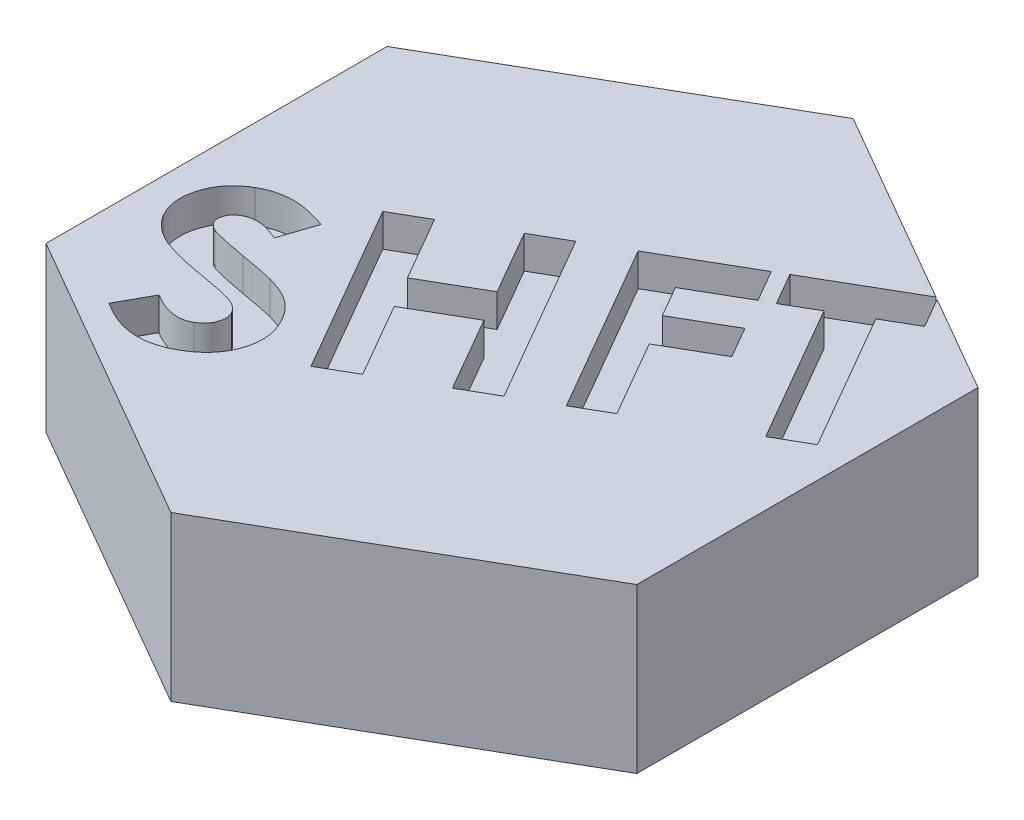
from build123d import *

# Parameters (mm, degrees)
BOSS_EXTRUDE1_DEPTH = 5
SHELL1_T            = -1
BOSS_EXTRUDE2_DEPTH = 2
SKETCH3_W           = 6.8
SKETCH3_H           = 4.9
BOSS_EXTRUDE3_DEPTH = 3.5
CUT_EXTRUDE1_DEPTH  = 3.5
CUT_EXTRUDE2_DEPTH  = 1


with BuildPart() as part:
    # Sketch1 → Boss-Extrude1 (new body)
    with BuildSketch(Plane(origin=(0, 0, 0), x_dir=(1, 0, 0), z_dir=(0, 1, 0))):
        Polygon((9.025, 5.210586179), (0, 10.421172359), (-9.025, 5.210586179), (-9.025, -5.210586179), (0, -10.421172359), (9.025, -5.210586179), align=None)
    extrude(amount=BOSS_EXTRUDE1_DEPTH)

    # Shell1
    shell1_openings = [part.faces().sort_by_distance(p)[0] for p in [
        (0, 0, 0),
    ]]
    offset(amount=SHELL1_T, openings=shell1_openings, kind=Kind.INTERSECTION)

    # Sketch2 → Boss-Extrude2 (add)
    with BuildSketch(Plane.XZ.offset(-4)):
        Polygon((8.025, -4.63323591), (8.025, 4.63323591), (0, 9.26647182), (-8.025, 4.63323591), (-8.025, -4.63323591), (0, -9.26647182), align=None)
    extrude(amount=BOSS_EXTRUDE2_DEPTH)

    # Sketch3 → Boss-Extrude3 (add)
    with BuildSketch(Plane.XZ.offset(-2)):
        Rectangle(SKETCH3_W, SKETCH3_H)
    extrude(amount=BOSS_EXTRUDE3_DEPTH)

    # Sketch4 → Cut-Extrude1 (cut)
    with BuildSketch(Plane.XZ.offset(1.5)):
        Polygon((2.1, -0.65), (2.1, 0.65), (0.75, 0.65), (0.75, 2.1), (-0.75, 2.1), (-0.75, 0.65), (-2.1, 0.65), (-2.1, -0.65), (-0.75, -0.65), (-0.75, -2.1), (0.75, -2.1), (0.75, -0.65), align=None)
    extrude(amount=-CUT_EXTRUDE1_DEPTH, mode=Mode.SUBTRACT)

    # Sketch5 → Cut-Extrude2 (cut)
    with BuildSketch(Plane(origin=(0, 5, 0), x_dir=(1, 0, 0), z_dir=(0, 1, 0))):
        with BuildLine():
            Line((-5.325433461, -0.506892934), (-5.682404615, -1.575402549))
            add(Edge.make_bspline(
                [(-5.682404615, -1.575402549), (-5.738611571, -1.55146657), (-5.846580721, -1.505487433), (-6.00645553, -1.450457601), (-6.157396888, -1.414148084), (-6.299119737, -1.39335946), (-6.432402529, -1.39262203), (-6.556831326, -1.405715783), (-6.672502146, -1.438161724), (-6.741797161, -1.473664937), (-6.776154615, -1.491267934)],
                knots=[0, 0, 0, 0, 1.28771263, 2.473594846, 3.559332536, 4.55671893, 5.485823958, 6.361652317, 7.187683927, 8, 8, 8, 8], degree=3))
            add(Edge.make_bspline(
                [(-6.776154615, -1.491267934), (-6.806492545, -1.510352721), (-6.864710582, -1.546976143), (-6.938739485, -1.61588131), (-6.99599337, -1.693290765), (-7.035307029, -1.777376197), (-7.058013134, -1.861350567), (-7.065305532, -1.942177188), (-7.054051685, -2.018272363), (-7.032137808, -2.062995336), (-7.021346922, -2.085017934)],
                knots=[0, 0, 0, 0, 1.209748172, 2.321488709, 3.39707423, 4.445359682, 5.44094777, 6.3240213, 7.174710374, 8, 8, 8, 8], degree=3))
            add(Edge.make_bspline(
                [(-7.021346922, -2.085017934), (-7.007656472, -2.106037373), (-6.980319555, -2.148008721), (-6.925567054, -2.201021253), (-6.862951825, -2.247786346), (-6.815080973, -2.270504668), (-6.790577692, -2.282133319)],
                knots=[0, 0, 0, 0, 0.973157049, 1.943187581, 2.947195419, 4, 4, 4, 4], degree=3))
            add(Edge.make_bspline(
                [(-6.790577692, -2.282133319), (-6.769858792, -2.290097745), (-6.7215347, -2.308673716), (-6.63598808, -2.33053668), (-6.529832527, -2.359308535), (-6.401725396, -2.388293787), (-6.252497256, -2.421379678), (-6.081066664, -2.454151642), (-5.88849741, -2.491724711), (-5.752544005, -2.516649981), (-5.681202692, -2.529729472)],
                knots=[0, 0, 0, 0, 0.467887767, 1.091286356, 1.859988272, 2.788638217, 3.861161716, 5.084362453, 6.470024239, 8, 8, 8, 8], degree=3))
            add(Edge.make_bspline(
                [(-5.681202692, -2.529729472), (-5.614688545, -2.541707449), (-5.488466865, -2.564437657), (-5.309075132, -2.597398063), (-5.149619325, -2.624932828), (-5.010942301, -2.653591474), (-4.892650506, -2.677133355), (-4.794430155, -2.697661701), (-4.716489125, -2.714957182), (-4.671549695, -2.727498295), (-4.652356538, -2.732854472)],
                knots=[0, 0, 0, 0, 1.546287761, 2.93433875, 4.173173077, 5.24819644, 6.174012619, 6.932675225, 7.544156831, 8, 8, 8, 8], degree=3))
            add(Edge.make_bspline(
                [(-4.652356538, -2.732854472), (-4.576623584, -2.754433542), (-4.430948197, -2.795941753), (-4.228232443, -2.875630456), (-4.047908963, -2.962859498), (-3.890344122, -3.062664527), (-3.751179655, -3.17552418), (-3.624703925, -3.301019132), (-3.512720637, -3.444029872), (-3.448277986, -3.547923786), (-3.415577692, -3.600642934)],
                knots=[0, 0, 0, 0, 1.214203853, 2.335570051, 3.355534606, 4.300291848, 5.205716251, 6.114761862, 7.043368914, 8, 8, 8, 8], degree=3))
            add(Edge.make_bspline(
                [(-3.415577692, -3.600642934), (-3.386940184, -3.653439855), (-3.330617955, -3.757277112), (-3.264417801, -3.919102949), (-3.215768933, -4.082115905), (-3.185465465, -4.246531266), (-3.173372547, -4.41177459), (-3.179504364, -4.578223869), (-3.204041341, -4.745238515), (-3.244721037, -4.911960498), (-3.30204991, -5.075343685), (-3.377031051, -5.231803254), (-3.467113417, -5.380417938), (-3.574802899, -5.519417001), (-3.695616106, -5.652007924), (-3.834104159, -5.775095202), (-3.988505341, -5.889617335), (-4.100107682, -5.957675309), (-4.15716423, -5.992469857)],
                knots=[0, 0, 0, 0, 1.025678726, 2.017232489, 2.981083202, 3.927665712, 4.867989921, 5.806443481, 6.767762737, 7.747334686, 8.73460219, 9.720539785, 10.706714995, 11.69798516, 12.720254519, 13.76740984, 14.858591258, 16, 16, 16, 16], degree=3))
            add(Edge.make_bspline(
                [(-4.15716423, -5.992469857), (-4.2029151, -6.017928425), (-4.293326345, -6.068238741), (-4.43299698, -6.132088815), (-4.573498408, -6.183443266), (-4.714079103, -6.224567518), (-4.854784589, -6.256505215), (-4.996764563, -6.275817947), (-5.139055192, -6.282263566), (-5.281711595, -6.280685803), (-5.425609337, -6.265765459), (-5.571059365, -6.239249342), (-5.718130016, -6.200666559), (-5.86656675, -6.149043701), (-6.01792839, -6.088380432), (-6.170664985, -6.014503942), (-6.325132479, -5.928971262), (-6.426330514, -5.864420115), (-6.478077692, -5.831412165)],
                knots=[0, 0, 0, 0, 1.017774509, 2.011289818, 2.982347635, 3.9240255, 4.857710421, 5.785363618, 6.705792502, 7.625165849, 8.556898814, 9.514964358, 10.497515854, 11.510029584, 12.568949849, 13.666508622, 14.80677927, 16, 16, 16, 16], degree=3))
            Line((-6.478077692, -5.831412165), (-5.93841423, -4.849441011))
            add(Edge.make_bspline(
                [(-5.93841423, -4.849441011), (-5.876066943, -4.885737418), (-5.756838552, -4.955148012), (-5.576733209, -5.038518479), (-5.405875784, -5.100678252), (-5.242445562, -5.135796737), (-5.0879048, -5.149004574), (-4.941778751, -5.138495445), (-4.803236577, -5.10468289), (-4.720183882, -5.061876928), (-4.678798845, -5.04054678)],
                knots=[0, 0, 0, 0, 1.293579815, 2.47374744, 3.555769028, 4.54819344, 5.46380976, 6.3287118, 7.167199521, 8, 8, 8, 8], degree=3))
            add(Edge.make_bspline(
                [(-4.678798845, -5.04054678), (-4.638936237, -5.015446967), (-4.561347561, -4.966592631), (-4.464150913, -4.872487164), (-4.387701145, -4.765879064), (-4.334443541, -4.648855696), (-4.303317377, -4.529157536), (-4.294197846, -4.412572162), (-4.313533945, -4.301642045), (-4.345449099, -4.235867679), (-4.361491153, -4.202806396)],
                knots=[0, 0, 0, 0, 1.138617944, 2.216208663, 3.252996335, 4.299549031, 5.311698101, 6.23549815, 7.113078549, 8, 8, 8, 8], degree=3))
            add(Edge.make_bspline(
                [(-4.361491153, -4.202806396), (-4.380010417, -4.173871492), (-4.4175359, -4.115240856), (-4.4965852, -4.041680531), (-4.589626245, -3.976678965), (-4.680359291, -3.930555918), (-4.765056268, -3.897993387), (-4.843056545, -3.872966048), (-4.933757848, -3.846171338), (-5.038856401, -3.822065238), (-5.155920712, -3.794858002), (-5.286890039, -3.77045363), (-5.430568678, -3.743553698), (-5.531326246, -3.727039534), (-5.583846922, -3.718431396)],
                knots=[0, 0, 0, 0, 0.909424095, 1.84276103, 2.843738267, 3.919499091, 4.536166438, 5.253068241, 6.095165878, 7.047724124, 8.116724405, 9.287726519, 10.586206066, 12, 12, 12, 12], degree=3))
            add(Edge.make_bspline(
                [(-5.583846922, -3.718431396), (-5.683655771, -3.701485292), (-5.875498665, -3.668913133), (-6.150918918, -3.617525985), (-6.401889951, -3.56506577), (-6.628381182, -3.511091226), (-6.830571857, -3.456261035), (-7.008205883, -3.400069991), (-7.161834982, -3.344104119), (-7.293538663, -3.286043885), (-7.407482868, -3.222236129), (-7.512689732, -3.158161164), (-7.608810661, -3.087752964), (-7.698405428, -3.014463112), (-7.780415921, -2.936493879), (-7.853571897, -2.853349852), (-7.919489932, -2.766364229), (-7.956953592, -2.704748877), (-7.975673845, -2.673960242)],
                knots=[0, 0, 0, 0, 1.801703634, 3.463060095, 4.985942132, 6.364289375, 7.606258193, 8.713464438, 9.679023598, 10.515207159, 11.27148115, 12.001589174, 12.706147237, 13.389942357, 14.060675862, 14.717353214, 15.359072975, 16, 16, 16, 16], degree=3))
            add(Edge.make_bspline(
                [(-7.975673845, -2.673960242), (-7.999795613, -2.629122769), (-8.047616039, -2.540234299), (-8.103161683, -2.400567973), (-8.141164791, -2.257609045), (-8.166399838, -2.112801598), (-8.172416775, -1.965223955), (-8.166195079, -1.81528572), (-8.140455592, -1.663084625), (-8.103487814, -1.509287165), (-8.048666477, -1.358978393), (-7.983473223, -1.214192623), (-7.903174289, -1.078774796), (-7.810666895, -0.951928095), (-7.703446581, -0.834805086), (-7.584683375, -0.725513924), (-7.452816447, -0.6246676), (-7.357251696, -0.566533109), (-7.308606538, -0.536941011)],
                knots=[0, 0, 0, 0, 0.980347626, 1.943499407, 2.887156219, 3.826129841, 4.768902428, 5.727093312, 6.711776165, 7.737615518, 8.770284615, 9.789131514, 10.792512546, 11.797495335, 12.808358981, 13.846235693, 14.903673103, 16, 16, 16, 16], degree=3))
            add(Edge.make_bspline(
                [(-7.308606538, -0.536941011), (-7.243289176, -0.501983178), (-7.113314521, -0.43242078), (-6.904353926, -0.35846878), (-6.687820942, -0.308992515), (-6.500600952, -0.28813955), (-6.344609626, -0.287208489), (-6.219649665, -0.29249956), (-6.087866756, -0.309558499), (-5.948942979, -0.331728905), (-5.802667888, -0.363649134), (-5.649701479, -0.403532254), (-5.488917483, -0.449902409), (-5.38095366, -0.487538594), (-5.325433461, -0.506892934)],
                knots=[0, 0, 0, 0, 1.296925376, 2.580744562, 3.870196999, 5.183781057, 5.871953614, 6.603064647, 7.373865503, 8.19924855, 9.068280055, 9.996460477, 10.96968344, 12, 12, 12, 12], degree=3))
        make_face()
        Polygon((-4.727074029, 0.779164758), (-3.724670183, 1.357289758), (-2.592458644, -0.601844857), (-0.855679798, 0.401760912), (-1.987891337, 2.360895528), (-0.98909326, 2.937818604), (2.01090674, -2.255691011), (1.012108663, -2.832614088), (-0.302795183, -0.554969857), (-2.039574029, -1.558575626), (-0.724670183, -3.836219857), (-1.727074029, -4.414344857), align=None)
        Polygon((0.219435962, 3.634933989), (2.797560962, 5.122914758), (3.355253269, 4.158972451), (1.755493654, 3.235895528), (2.298762885, 2.293587835), (3.8985225, 3.216664758), (4.447801346, 2.267145528), (2.848041731, 1.344068604), (4.197801346, -0.99367178), (3.219435962, -1.558575626), align=None)
        Polygon((3.158297192, 5.330847451), (6.0284895, 6.988299374), (6.592191423, 6.013539758), (5.646277961, 5.467866681), (8.082576038, 1.249116681), (7.078970269, 0.669789758), (4.642672192, 4.888539758), (3.721999115, 4.356087835), align=None)
    extrude(amount=-CUT_EXTRUDE2_DEPTH, mode=Mode.SUBTRACT)


solid = part.part
